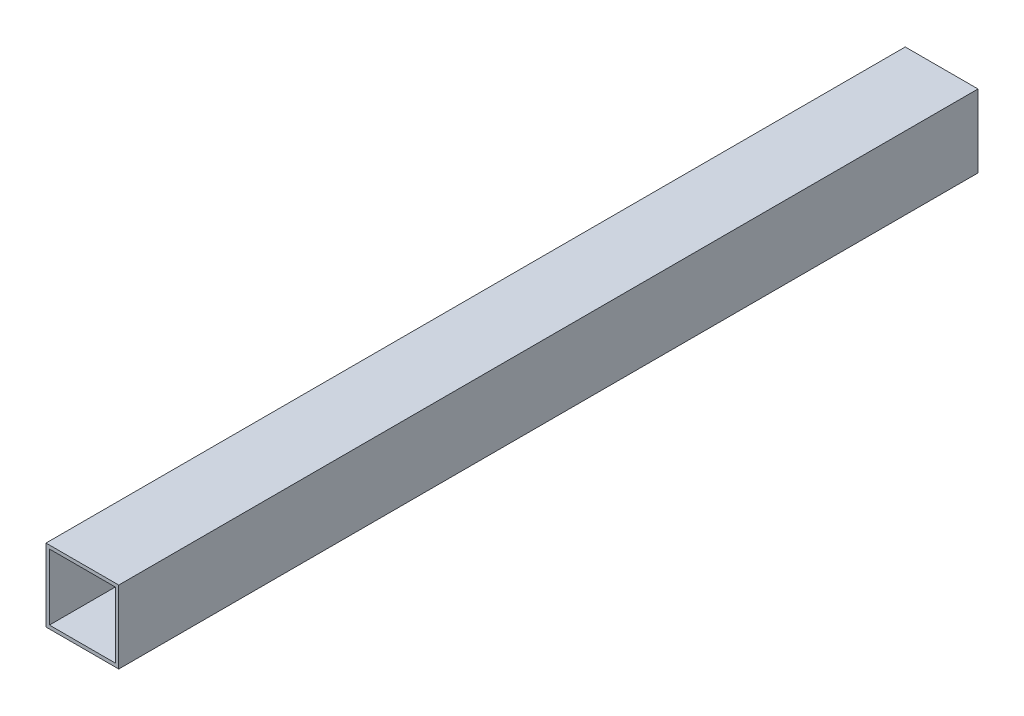
from build123d import *

# Parameters (mm, degrees)
SKETCH1_W           = 25.4
SKETCH1_H           = 25.4
SKETCH1_W_2         = 23
SKETCH1_H_2         = 23
BOSS_EXTRUDE1_DEPTH = 150


with BuildPart() as part:
    # Sketch1 → Boss-Extrude1 (new, symmetric)
    with BuildSketch(Plane.XY):
        Rectangle(SKETCH1_W, SKETCH1_H)
        Rectangle(SKETCH1_W_2, SKETCH1_H_2, mode=Mode.SUBTRACT)
    extrude(amount=BOSS_EXTRUDE1_DEPTH, both=True)


solid = part.part
